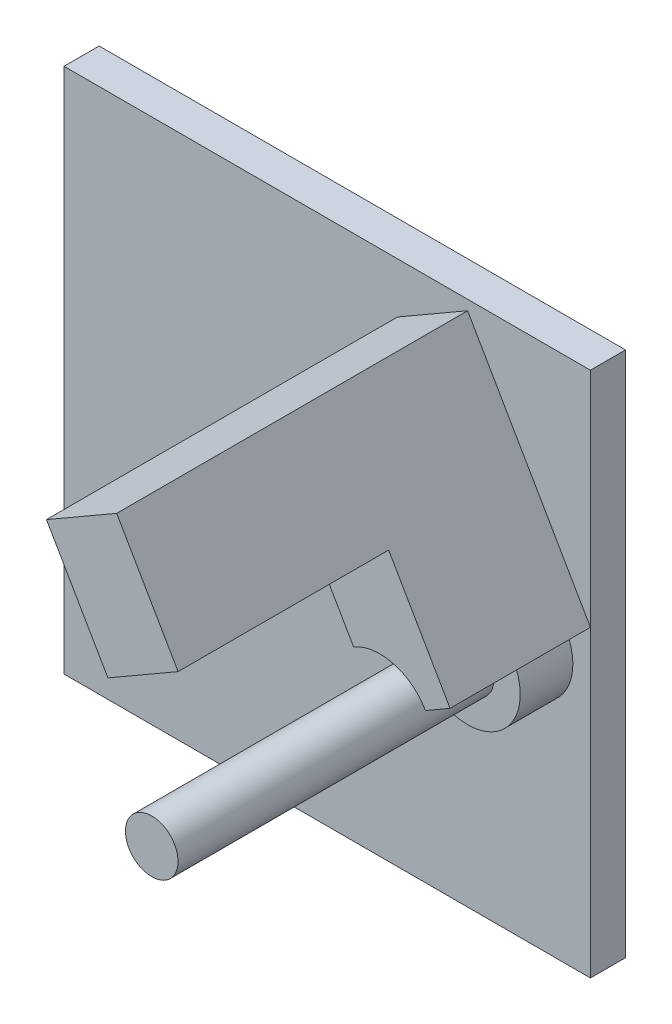
from build123d import *

# Parameters (mm, degrees)
CROQUIS1_W              = 30
CROQUIS1_H              = 30
SALIENTE_EXTRUIR1_DEPTH = 2
CROQUIS2_R              = 3
SALIENTE_EXTRUIR2_DEPTH = 3
CROQUIS3_R              = 1.5
SALIENTE_EXTRUIR3_DEPTH = 18
SALIENTE_EXTRUIR4_DEPTH = 20
CORTAR_EXTRUIR1_START   = -12
CORTAR_EXTRUIR1_DEPTH   = 12


with BuildPart() as part:
    # Croquis1 → Saliente-Extruir1 (new body)
    with BuildSketch(Plane.XY):
        Rectangle(CROQUIS1_W, CROQUIS1_H)
    extrude(amount=SALIENTE_EXTRUIR1_DEPTH)

    # Croquis2 → Saliente-Extruir2 (add)
    with BuildSketch(Plane.XY.offset(2)):
        with Locations((11, 0)):
            Circle(CROQUIS2_R)
    extrude(amount=SALIENTE_EXTRUIR2_DEPTH)

    # Croquis3 → Saliente-Extruir3 (add)
    with BuildSketch(Plane.XY.offset(5)):
        with Locations((11, 0)):
            Circle(CROQUIS3_R)
    extrude(amount=SALIENTE_EXTRUIR3_DEPTH)

    # Croquis5 → Saliente-Extruir4 (add)
    with BuildSketch(Plane.XY.offset(2)):
        with BuildLine():
            ThreePointArc((9.5, 2.598076211), (11.776457135, 2.897777479), (13.598076211, 1.5))
            Line((13.598076211, 1.5), (15, 2.309401077))
            Line((15, 2.309401077), (8, 14.43375673))
            Line((8, 14.43375673), (4, 12.124355653))
            Line((4, 12.124355653), (9.5, 2.598076211))
        make_face()
    extrude(amount=SALIENTE_EXTRUIR4_DEPTH)

    # Croquis7 → Cortar-Extruir1 (cut)
    with BuildSketch(Plane.XY.offset(22).offset(CORTAR_EXTRUIR1_START)):
        with BuildLine():
            Line((7.5, 6.062177826), (11.5, 8.371578903))
            Line((11.5, 8.371578903), (15, 2.309401077))
            Line((15, 2.309401077), (13.598076211, 1.5))
            ThreePointArc((13.598076211, 1.5), (11.776457135, 2.897777479), (9.5, 2.598076211))
            Line((9.5, 2.598076211), (7.5, 6.062177826))
        make_face()
    extrude(amount=CORTAR_EXTRUIR1_DEPTH, mode=Mode.SUBTRACT)


solid = part.part
